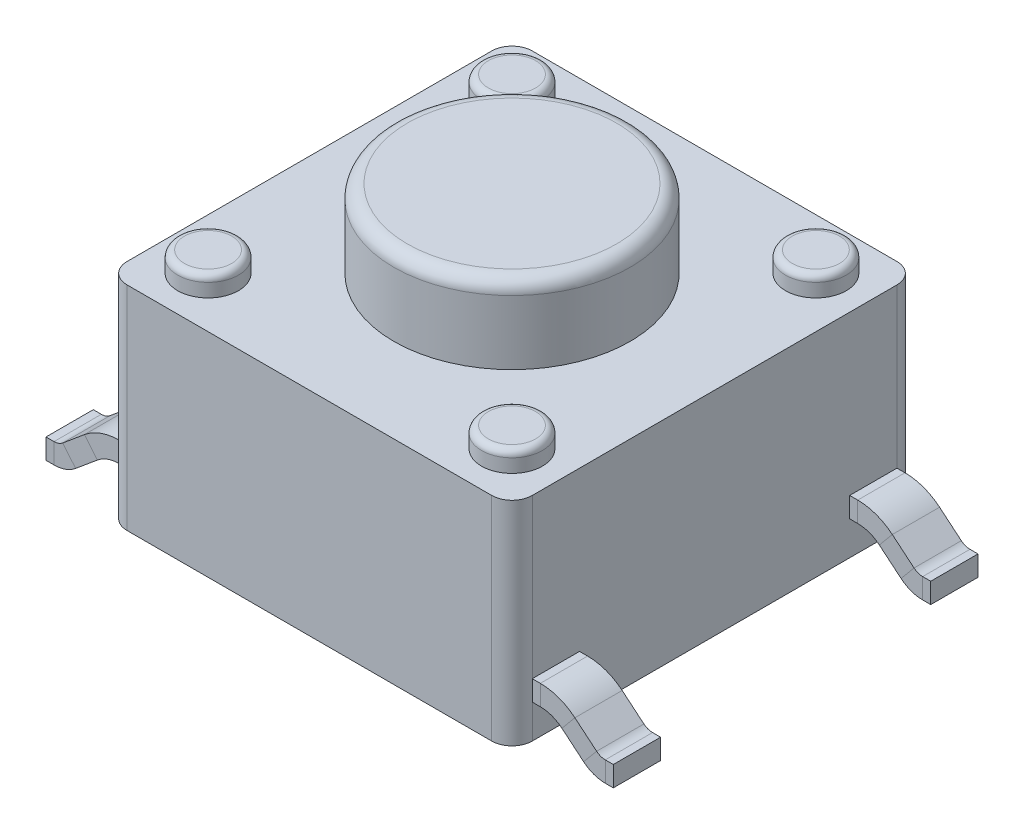
from build123d import *

# Parameters (mm, degrees)
BOSS_EXTRUDE1_DEPTH     = 3.15
SKETCH2_R               = 1.75
BOSS_EXTRUDE2_DEPTH     = 1.15
FILLET1_R               = 0.2
SKETCH3_R               = 0.45
BOSS_EXTRUDE3_DEPTH     = 0.3
SKETCH4_W               = 0.7
SKETCH4_H               = 0.3
MIRROR2_COPY_1_SKETCH_W = 0.7
MIRROR2_COPY_1_SKETCH_H = 0.3
FILLET2_R               = 0.1


with BuildPart() as part:
    # Sketch1 → Boss-Extrude1 (new body)
    with BuildSketch(Plane(origin=(0, 0, 0), x_dir=(1, 0, 0), z_dir=(0, 1, 0))):
        with BuildLine():
            Line((-2.7, 3), (2.7, 3))
            ThreePointArc((2.7, 3), (2.912132034, 2.912132034), (3, 2.7))
            Line((3, 2.7), (3, -2.7))
            ThreePointArc((3, -2.7), (2.912132034, -2.912132034), (2.7, -3))
            Line((2.7, -3), (-2.7, -3))
            ThreePointArc((-2.7, -3), (-2.912132034, -2.912132034), (-3, -2.7))
            Line((-3, -2.7), (-3, 2.7))
            ThreePointArc((-3, 2.7), (-2.912132034, 2.912132034), (-2.7, 3))
        make_face()
    extrude(amount=BOSS_EXTRUDE1_DEPTH)

    # Sketch2 → Boss-Extrude2 (add)
    with BuildSketch(Plane(origin=(0, 3.15, 0), x_dir=(1, 0, 0), z_dir=(0, 1, 0))):
        with Locations(Location((0, 0, 0), (0, 0, 270))):
            Circle(SKETCH2_R)
    extrude(amount=BOSS_EXTRUDE2_DEPTH)

    # Fillet1
    fillet1_edges = [part.edges().sort_by_distance(p)[0] for p in [
        (0, 4.3, -1.75),
    ]]
    fillet(fillet1_edges, radius=FILLET1_R)

    # Sketch3 → Boss-Extrude3 (add)
    with BuildSketch(Plane(origin=(0, 3.15, 0), x_dir=(1, 0, 0), z_dir=(0, 1, 0))):
        with Locations(Location((-2.25, 2.25, 0), (0, 0, 270))):
            Circle(SKETCH3_R)
        with Locations(Location((2.25, 2.25, 0), (0, 0, 270))):
            Circle(SKETCH3_R)
        with Locations(Location((2.25, -2.25, 0), (0, 0, 270))):
            Circle(SKETCH3_R)
        with Locations(Location((-2.25, -2.25, 0), (0, 0, 270))):
            Circle(SKETCH3_R)
    extrude(amount=BOSS_EXTRUDE3_DEPTH)

    # Sweep1: sweep along a path in Sketch5
    with BuildLine(Plane.XY.offset(2.7)) as sweep1_path:
        Line((3, 0.5), (3.118975032, 0.5))
        ThreePointArc((3.118975032, 0.5), (3.289187664, 0.470135789), (3.439067232, 0.38411064))
        Line((3.439067232, 0.38411064), (3.760932768, 0.11588936))
        ThreePointArc((3.760932768, 0.11588936), (3.910812336, 0.029864211), (4.081024968, 0))
        Line((4.081024968, 0), (4.2, 0))
    # Sketch4 → Sweep1 (sweep)
    with BuildSketch(Plane(origin=(3, 0, 0), x_dir=(0, 0, -1), z_dir=(1, 0, 0))):
        with Locations((-2.35, 0.65)):
            Rectangle(SKETCH4_W, SKETCH4_H)
    sweep1 = sweep(path=sweep1_path.line)

    # Mirror1: Sweep1 across plane
    add(sweep1.mirror(Plane.XY))

    # Mirror2: Sweep1 across plane
    add(sweep1.mirror(Plane(origin=(0, 0, 0), x_dir=(0, 0, 1), z_dir=(1, 0, 0))))

    # Mirror2 copy 1: sweep along a path in Mirror2 copy 1 path
    with BuildLine(Plane(origin=(0, 0, -2.7), x_dir=(-1, 0, 0), z_dir=(0, 0, -1))) as mirror2_copy_1_path:
        Line((3, 0.5), (3.118975032, 0.5))
        ThreePointArc((3.118975032, 0.5), (3.289187664, 0.470135789), (3.439067232, 0.38411064))
        Line((3.439067232, 0.38411064), (3.760932768, 0.11588936))
        ThreePointArc((3.760932768, 0.11588936), (3.910812336, 0.029864211), (4.081024968, 0))
        Line((4.081024968, 0), (4.2, 0))
    # Mirror2 copy 1 sketch → Mirror2 copy 1 (sweep)
    with BuildSketch(Plane.ZY.offset(3)):
        with Locations((-2.35, 0.65)):
            Rectangle(MIRROR2_COPY_1_SKETCH_W, MIRROR2_COPY_1_SKETCH_H)
    sweep(path=mirror2_copy_1_path.line)

    # Fillet2
    fillet2_edges = [part.edges().sort_by_distance(p)[0] for p in [
        (-2.25, 3.45, -2.7),
        (2.25, 3.45, -2.7),
        (2.25, 3.45, 1.8),
        (-2.25, 3.45, 1.8),
    ]]
    fillet(fillet2_edges, radius=FILLET2_R)


solid = part.part
